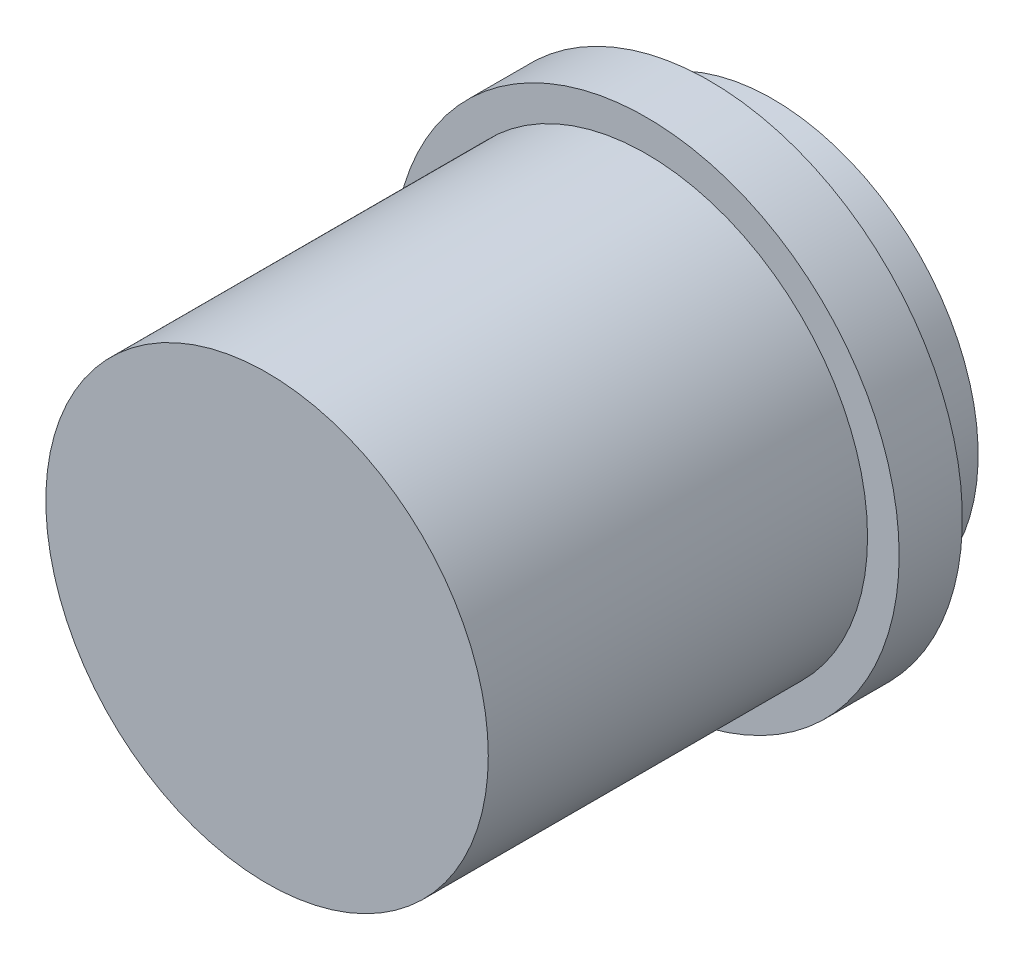
from build123d import *

# Parameters (mm, degrees)
SZKIC1_R                    = 8
DODANIE_WYCI_GNI_CIE1_DEPTH = 16
WYTNIJ_WYCI_GNI_CIE1_START  = -12
SZKIC2_R                    = 8
SZKIC2_R_2                  = 7
WYTNIJ_WYCI_GNI_CIE1_DEPTH  = 12
SZKIC3_R                    = 8
SZKIC3_R_2                  = 6.5
WYTNIJ_WYCI_GNI_CIE2_DEPTH  = 2


with BuildPart() as part:
    # Szkic1 → Dodanie-wyciągnięcie1 (new body)
    with BuildSketch(Plane.XY):
        Circle(SZKIC1_R)
    extrude(amount=DODANIE_WYCI_GNI_CIE1_DEPTH)

    # Szkic2 → Wytnij-wyciągnięcie1 (cut)
    with BuildSketch(Plane.XY.offset(16).offset(WYTNIJ_WYCI_GNI_CIE1_START)):
        Circle(SZKIC2_R)
        Circle(SZKIC2_R_2, mode=Mode.SUBTRACT)
    extrude(amount=WYTNIJ_WYCI_GNI_CIE1_DEPTH, mode=Mode.SUBTRACT)

    # Szkic3 → Wytnij-wyciągnięcie2 (cut)
    with BuildSketch(Plane(origin=(0, 0, 0), x_dir=(-1, 0, 0), z_dir=(0, 0, -1))):
        Circle(SZKIC3_R)
        Circle(SZKIC3_R_2, mode=Mode.SUBTRACT)
    extrude(amount=-WYTNIJ_WYCI_GNI_CIE2_DEPTH, mode=Mode.SUBTRACT)


solid = part.part
